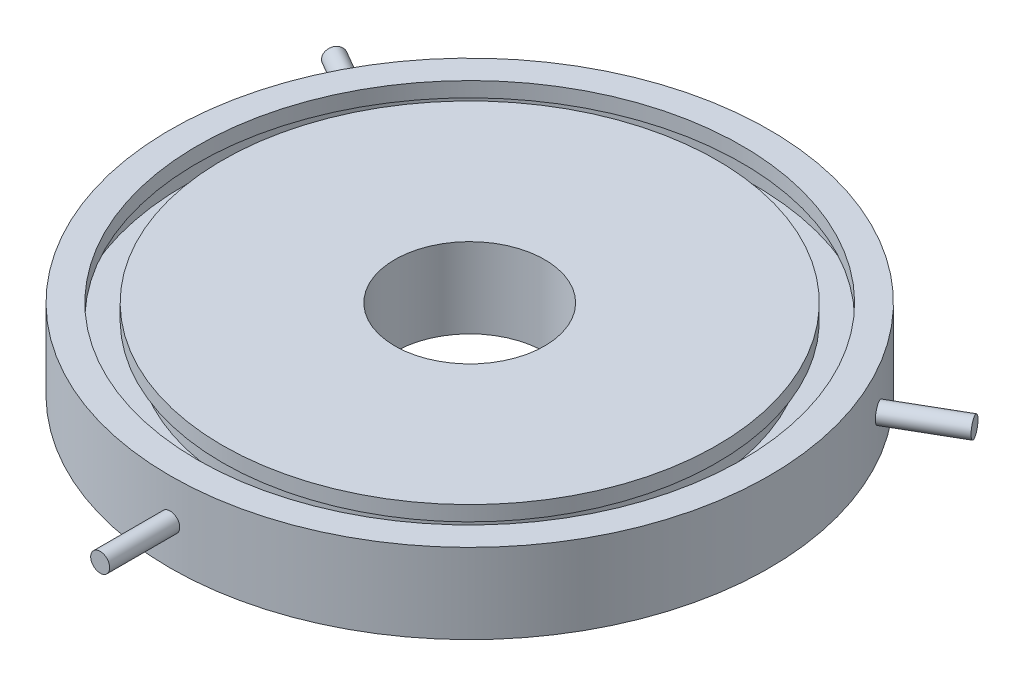
from build123d import *

# Parameters (mm, degrees)
SKETCH1_R           = 30
SKETCH1_R_2         = 7.5
BOSS_EXTRUDE1_DEPTH = 4
BOSS_EXTRUDE2_START = 29
SKETCH3_R           = 0.95
BOSS_EXTRUDE2_DEPTH = 8
CIRPATTERN1_COUNT   = 3


with BuildPart() as part:
    # Sketch1 → Boss-Extrude1 (new, symmetric)
    with BuildSketch(Plane(origin=(0, 0, 0), x_dir=(1, 0, 0), z_dir=(0, 1, 0))):
        with Locations(Location((0, 0, 0), (0, 0, 270))):
            Circle(SKETCH1_R)
        with Locations(Location((0, 0, 0), (0, 0, 270))):
            Circle(SKETCH1_R_2, mode=Mode.SUBTRACT)
    extrude(amount=BOSS_EXTRUDE1_DEPTH, both=True)

    # Sketch2 → Cut-Revolve2 (revolve, cut)
    with BuildSketch(Plane(origin=(0, 0, 0), x_dir=(0, 0, -1), z_dir=(1, 0, 0))):
        Polygon((-27.25, 4), (-24.75, 4), (-24.75, 2.5), (-23.5, 2.5), (-23.5, -0.04), (-28.5, -0.04), (-28.5, 2.5), (-27.25, 2.5), align=None)
    revolve(axis=Axis((0, 8.260026976, 0), (0, -1, 0)), mode=Mode.SUBTRACT)

    # Sketch3 → Boss-Extrude2 (add)
    with BuildSketch(Plane.XY.offset(BOSS_EXTRUDE2_START)):
        with Locations(Location((0, 0, 0), (0, 0, 180))):
            Circle(SKETCH3_R)
    boss_extrude2 = extrude(amount=BOSS_EXTRUDE2_DEPTH)

    # CirPattern1: Boss-Extrude2 ×3 about axis
    cirpattern1_axis = Axis((0, 0, 0), (0, 1, 0))
    for i in range(1, CIRPATTERN1_COUNT):
        add(boss_extrude2.rotate(cirpattern1_axis, i * 360 / CIRPATTERN1_COUNT))


solid = part.part
